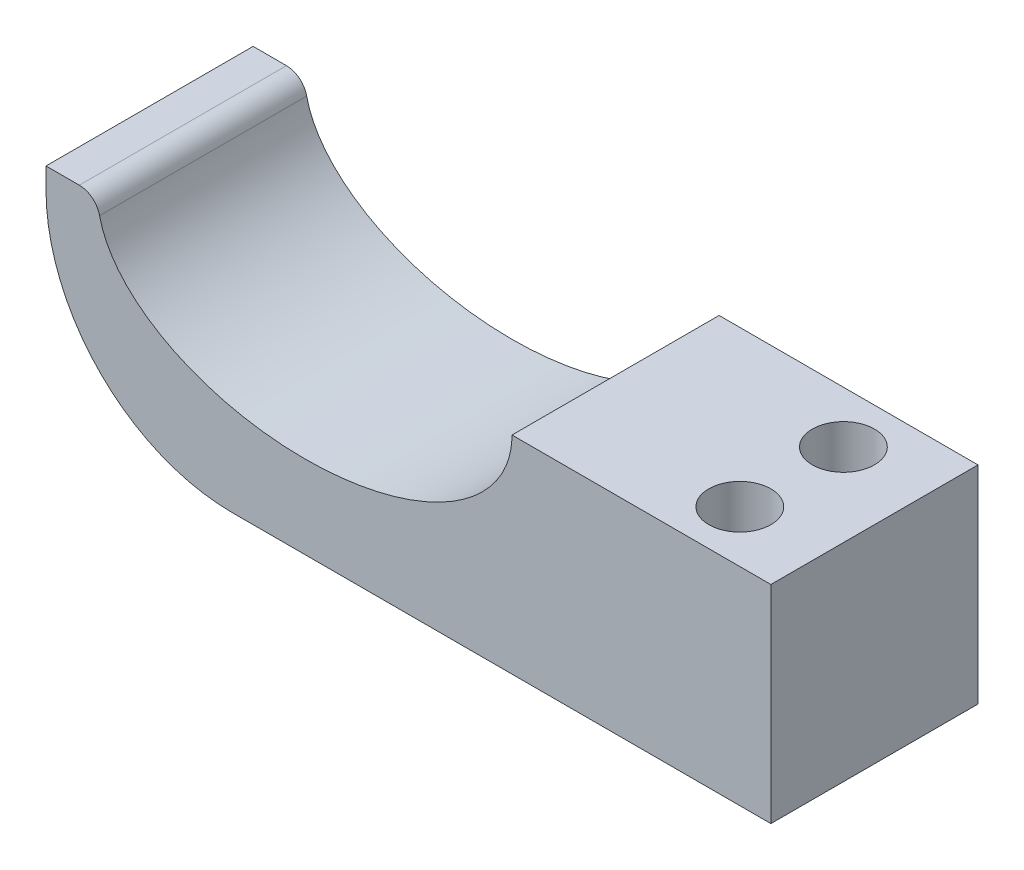
from build123d import *

# Parameters (mm, degrees)
SKETCH1_W           = 88.9
SKETCH1_H           = 25.4
BOSS_EXTRUDE1_DEPTH = 25.4
SKETCH2_RX          = 25.4
SKETCH2_RY          = 15.24
CUT_EXTRUDE1_DEPTH  = 58.15
FILLET1_R           = 2.54
SKETCH5_R           = 3.81
CUT_EXTRUDE2_DEPTH  = 53.747061686
FILLET2_R           = 22.86


with BuildPart() as part:
    # Sketch1 → Boss-Extrude1 (new body)
    with BuildSketch(Plane(origin=(0, 0, 0), x_dir=(1, 0, 0), z_dir=(0, 1, 0))):
        Rectangle(SKETCH1_W, SKETCH1_H)
    extrude(amount=BOSS_EXTRUDE1_DEPTH)

    # Sketch2 → Cut-Extrude1 (cut, through all)
    with BuildSketch(Plane.XY.offset(12.7)):
        with Locations(Location((-12.7, 25.4), (0, 0, 180))):
            Ellipse(SKETCH2_RX, SKETCH2_RY)
    extrude(amount=-CUT_EXTRUDE1_DEPTH, mode=Mode.SUBTRACT)

    # Fillet1
    fillet1_edges = [part.edges().sort_by_distance(p)[0] for p in [
        (-38.1, 25.4, 0),
    ]]
    fillet(fillet1_edges, radius=FILLET1_R)

    # Sketch5 → Cut-Extrude2 (cut, through all)
    with BuildSketch(Plane(origin=(0, 25.4, 0), x_dir=(1, 0, 0), z_dir=(0, 1, 0))):
        with Locations(Location((34.29, 6.35, 0), (0, 0, 270))):
            Circle(SKETCH5_R)
        with Locations(Location((34.29, -6.35, 0), (0, 0, 270))):
            Circle(SKETCH5_R)
    extrude(amount=-CUT_EXTRUDE2_DEPTH, mode=Mode.SUBTRACT)

    # Fillet2
    fillet2_edges = [part.edges().sort_by_distance(p)[0] for p in [
        (-44.45, 0, 0),
    ]]
    fillet(fillet2_edges, radius=FILLET2_R)


solid = part.part
